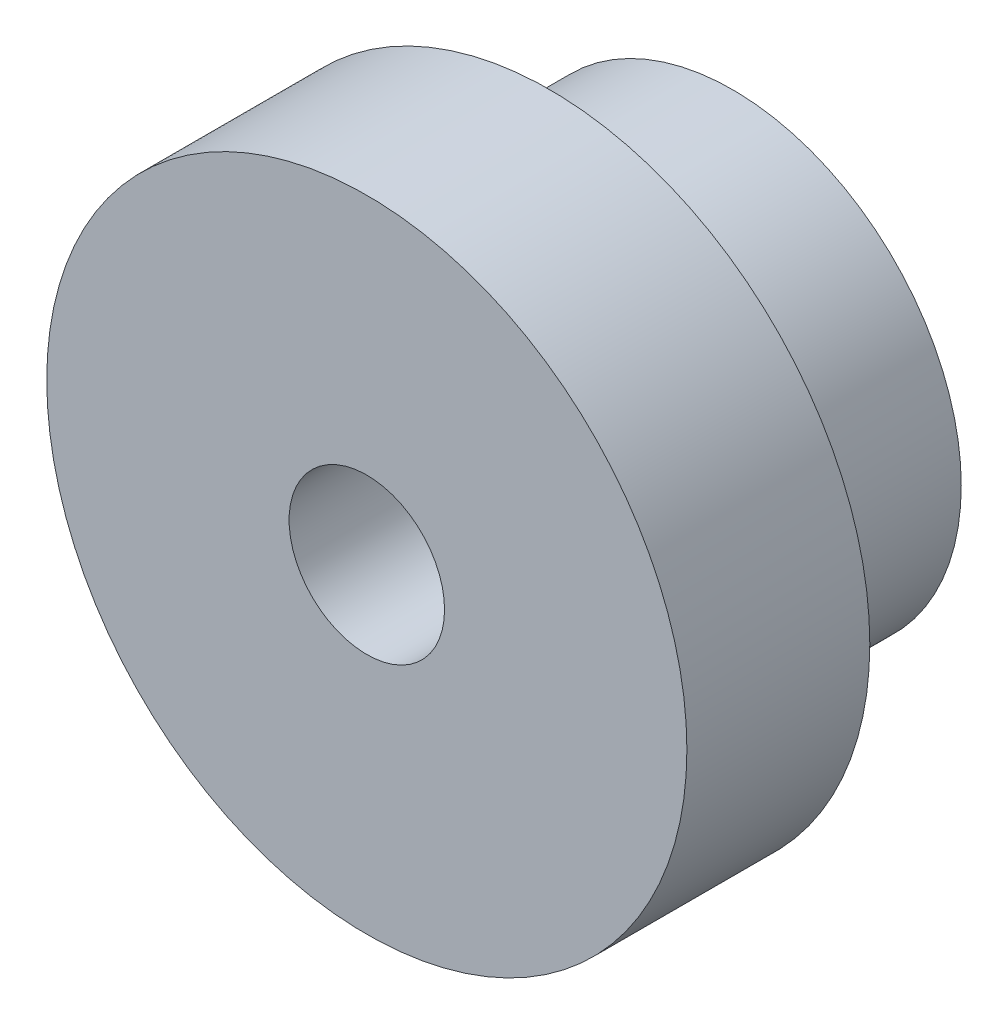
from build123d import *

# Parameters (mm, degrees)
CROQUIS1_R                   = 5
SALIENTE_EXTRUIR1_DEPTH      = 4
CROQUIS2_R                   = 7
SALIENTE_EXTRUIR2_DEPTH      = 4
TALADRO_DE_MARGEN_PARA_M31_D = 3.4


with BuildPart() as part:
    # Croquis1 → Saliente-Extruir1 (new body)
    with BuildSketch(Plane.XY):
        Circle(CROQUIS1_R)
    extrude(amount=SALIENTE_EXTRUIR1_DEPTH)

    # Croquis2 → Saliente-Extruir2 (add)
    with BuildSketch(Plane.XY.offset(4)):
        Circle(CROQUIS2_R)
    extrude(amount=SALIENTE_EXTRUIR2_DEPTH)

    # Taladro de margen para M31 (through all)
    with Locations(Plane.XY.offset(8)):
        with Locations((0, 0)):
            Hole(TALADRO_DE_MARGEN_PARA_M31_D / 2)


solid = part.part
